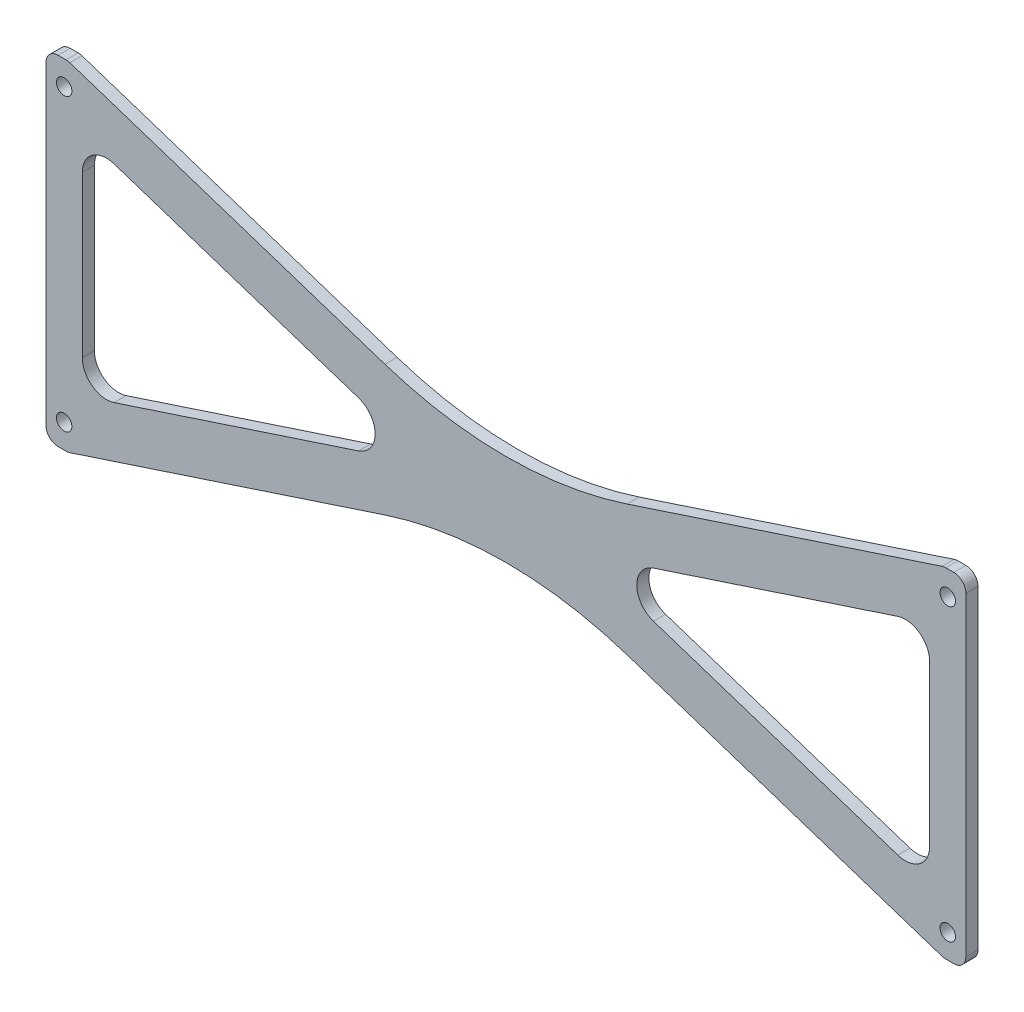
from build123d import *

# Parameters (mm, degrees)
BOSS_EXTRUDE1_DEPTH = 3.175
SKETCH3_R           = 2.032
CUT_EXTRUDE1_DEPTH  = 129.616894788
FILLET1_R           = 3.175
FILLET2_R           = 101.6
FILLET3_R           = 6.35


with BuildPart() as part:
    # Sketch2 → Boss-Extrude1 (new body)
    with BuildSketch(Plane.XY):
        Polygon((120.65, -44.45), (120.65, 44.45), (114.870442245, 44.45), (0, 6.684375152), (-114.870442245, 44.45), (-120.65, 44.45), (-120.65, -44.45), (-114.870442245, -44.45), (0, -6.684375152), (114.870442245, -44.45), align=None)
        Polygon((-111.125, 29.849871423), (-20.331641088, 0), (-111.125, -29.849871423), align=None, mode=Mode.SUBTRACT)
        Polygon((20.331641088, 0), (111.125, -29.849871423), (111.125, 29.849871423), align=None, mode=Mode.SUBTRACT)
    extrude(amount=BOSS_EXTRUDE1_DEPTH)

    # Sketch3 → Cut-Extrude1 (cut, through all)
    with BuildSketch(Plane.XY.offset(3.175)):
        with Locations((-115.8875, 38.1)):
            Circle(SKETCH3_R)
        with Locations((-115.8875, -38.1)):
            Circle(SKETCH3_R)
        with Locations((115.8875, 38.1)):
            Circle(SKETCH3_R)
        with Locations((115.8875, -38.1)):
            Circle(SKETCH3_R)
    extrude(amount=-CUT_EXTRUDE1_DEPTH, mode=Mode.SUBTRACT)

    # Fillet1
    fillet1_edges = [part.edges().sort_by_distance(p)[0] for p in [
        (114.870442245, -44.45, 1.5875),
        (-114.870442245, -44.45, 1.5875),
        (-120.65, -44.45, 1.5875),
        (-120.65, 44.45, 1.5875),
        (-114.870442245, 44.45, 1.5875),
        (114.870442245, 44.45, 1.5875),
        (120.65, 44.45, 1.5875),
        (120.65, -44.45, 1.5875),
    ]]
    fillet(fillet1_edges, radius=FILLET1_R)

    # Fillet2
    fillet2_edges = [part.edges().sort_by_distance(p)[0] for p in [
        (0, -6.684375152, 1.5875),
        (0, 6.684375152, 1.5875),
    ]]
    fillet(fillet2_edges, radius=FILLET2_R)

    # Fillet3
    fillet3_edges = [part.edges().sort_by_distance(p)[0] for p in [
        (-111.125, -29.849871423, 1.5875),
        (-20.331641088, 0, 1.5875),
        (-111.125, 29.849871423, 1.5875),
        (111.125, -29.849871423, 1.5875),
        (111.125, 29.849871423, 1.5875),
        (20.331641088, 0, 1.5875),
    ]]
    fillet(fillet3_edges, radius=FILLET3_R)


solid = part.part
